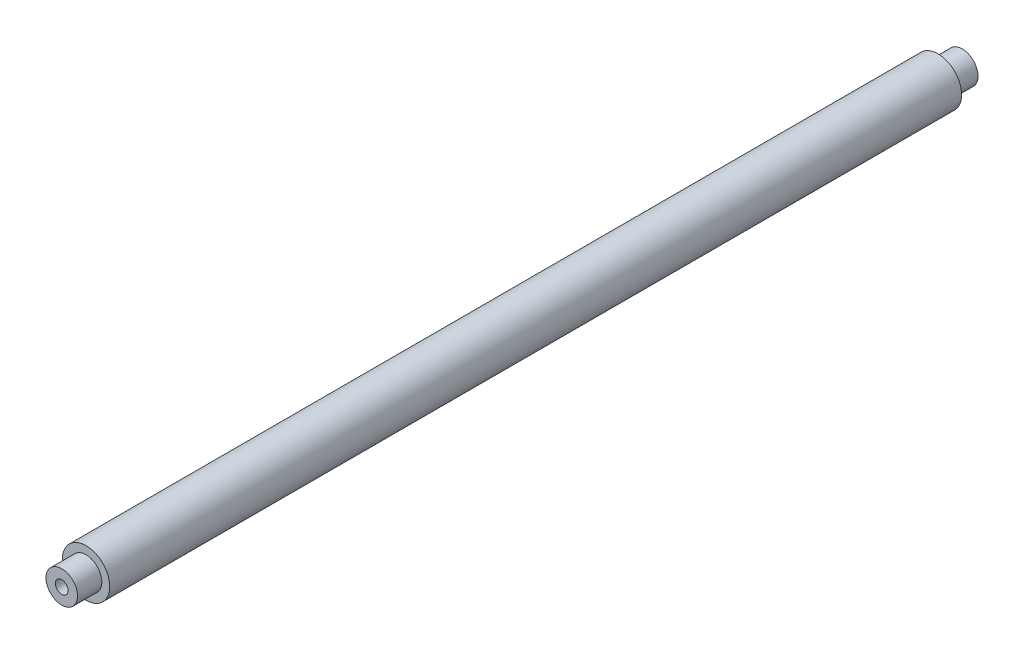
from build123d import *

# Parameters (mm, degrees)
SKETCH1_R                   = 9.525
BOSS_EXTRUDE1_DEPTH         = 342.9
SKETCH2_R                   = 6.35
BOSS_EXTRUDE2_DEPTH         = 9.779
F_1_4_20_TAPPED_HOLE1_D     = 5.1054
F_1_4_20_TAPPED_HOLE1_DEPTH = 25.4
F_1_4_20_TAPPED_HOLE1_TIP   = 1.533816902
BOSS_EXTRUDE3_START         = 9.779
SKETCH5_R                   = 6.35
BOSS_EXTRUDE3_DEPTH         = 9.779
F_1_4_20_TAPPED_HOLE2_D     = 5.1054
F_1_4_20_TAPPED_HOLE2_DEPTH = 25.4
F_1_4_20_TAPPED_HOLE2_TIP   = 1.533816902


with BuildPart() as part:
    # Sketch1 → Boss-Extrude1 (new body)
    with BuildSketch(Plane.XY):
        Circle(SKETCH1_R)
    extrude(amount=BOSS_EXTRUDE1_DEPTH)

    # Sketch2 → Boss-Extrude2 (add)
    with BuildSketch(Plane.XY.offset(342.9)):
        Circle(SKETCH2_R)
    extrude(amount=BOSS_EXTRUDE2_DEPTH)

    # 1/4-20 Tapped Hole1
    with Locations(Plane.XY.offset(352.679)):
        with Locations((0, 0)):
            Hole(F_1_4_20_TAPPED_HOLE1_D / 2, depth=F_1_4_20_TAPPED_HOLE1_DEPTH)
            with Locations((0, 0, -(F_1_4_20_TAPPED_HOLE1_DEPTH + F_1_4_20_TAPPED_HOLE1_TIP / 2))):  # 118° drill point
                Cone(0, F_1_4_20_TAPPED_HOLE1_D / 2, F_1_4_20_TAPPED_HOLE1_TIP, mode=Mode.SUBTRACT)

    # Sketch5 → Boss-Extrude3 (add)
    with BuildSketch(Plane(origin=(0, 0, 0), x_dir=(-1, 0, 0), z_dir=(0, 0, -1)).offset(BOSS_EXTRUDE3_START)):
        with Locations(Location((0, 0, 0), (0, 0, 180))):
            Circle(SKETCH5_R)
    extrude(amount=-BOSS_EXTRUDE3_DEPTH)

    # 1/4-20 Tapped Hole2
    with Locations(Plane(origin=(0, 0, -9.779), x_dir=(-1, 0, 0), z_dir=(0, 0, -1))):
        with Locations((0, 0)):
            Hole(F_1_4_20_TAPPED_HOLE2_D / 2, depth=F_1_4_20_TAPPED_HOLE2_DEPTH)
            with Locations((0, 0, -(F_1_4_20_TAPPED_HOLE2_DEPTH + F_1_4_20_TAPPED_HOLE2_TIP / 2))):  # 118° drill point
                Cone(0, F_1_4_20_TAPPED_HOLE2_D / 2, F_1_4_20_TAPPED_HOLE2_TIP, mode=Mode.SUBTRACT)


solid = part.part
